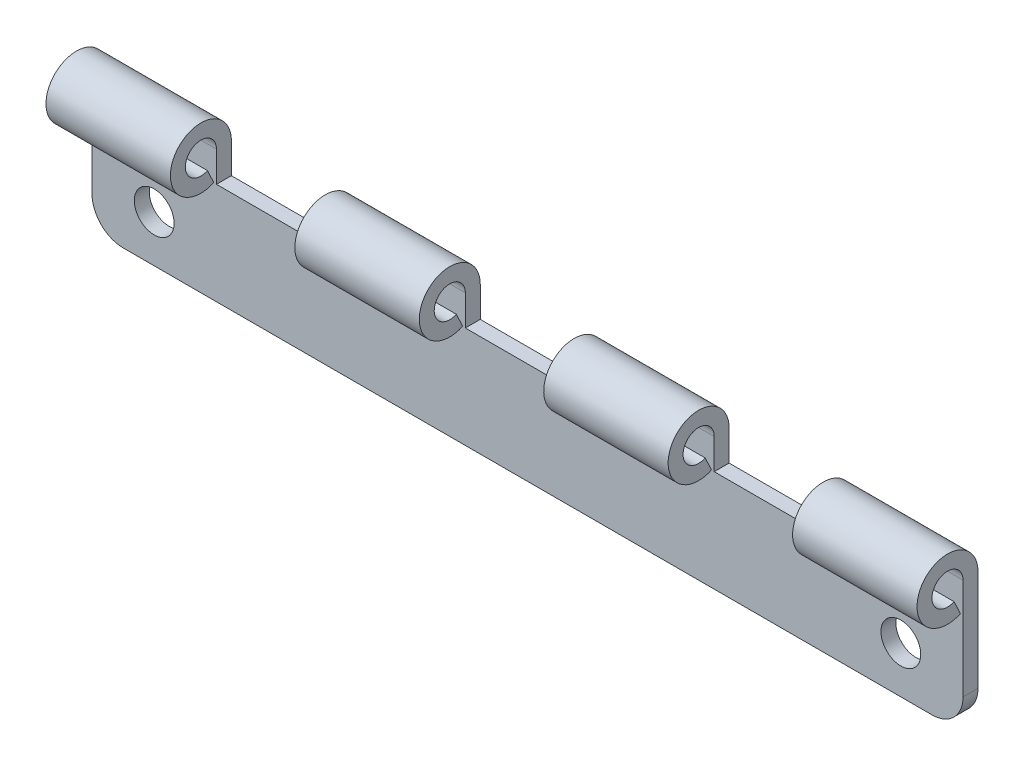
from build123d import *

# Parameters (mm, degrees)
BOSS_EXTRUDE1_DEPTH = 304.8
SKETCH4_W           = 12.7
SKETCH4_H           = 6.223
CUT_EXTRUDE1_DEPTH  = 306.114409233
LPATTERN1_COUNT     = 24
LPATTERN1_PITCH     = 25.4
BOSS_EXTRUDE2_DEPTH = 609.6
SKETCH6_W           = 12.7
SKETCH6_H           = 6.223
CUT_EXTRUDE2_DEPTH  = 306.114409233
LPATTERN2_COUNT     = 24
LPATTERN2_PITCH     = 25.4
SKETCH7_R           = 1.5875
BOSS_EXTRUDE3_DEPTH = 609.6
CHAMFER1_SIZE       = 0.3175
CUT_EXTRUDE3_START  = -88.9
SKETCH8_W           = 11.762471384
SKETCH8_H           = 30.066276354
CUT_EXTRUDE3_DEPTH  = 521.857265411
FILLET1_R           = 3.175
SKETCH9_R           = 2.032
CUT_EXTRUDE4_DEPTH  = 306.162001268


with BuildPart() as part:
    # Sketch3 → Boss-Extrude1 (new, symmetric)
    with BuildSketch(Plane(origin=(0, 0, 0), x_dir=(0, 0, -1), z_dir=(1, 0, 0))):
        with BuildLine():
            Line((1.5875, 0), (1.5875, -2.676056053))
            Line((1.5875, -2.676056053), (1.5875, -13.49375))
            Line((1.5875, -13.49375), (3.1115, -13.49375))
            Line((3.1115, -13.49375), (3.1115, 0))
            ThreePointArc((3.1115, 0), (-2.624212484, 1.671807731), (1.314976721, -2.819976679))
            Line((1.314976721, -2.819976679), (0.670906491, -1.438763612))
            ThreePointArc((0.670906491, -1.438763612), (-1.33888392, 0.852963128), (1.5875, 0))
        make_face()
    extrude(amount=BOSS_EXTRUDE1_DEPTH, both=True)

    # Sketch4 → Cut-Extrude1 (cut, symmetric)
    with BuildSketch(Plane.XY):
        with Locations((298.45, 0)):
            Rectangle(SKETCH4_W, SKETCH4_H)
    cut_extrude1 = extrude(amount=CUT_EXTRUDE1_DEPTH, both=True, mode=Mode.SUBTRACT)

    # LPattern1: Cut-Extrude1 ×24
    with Locations(*[(-i * LPATTERN1_PITCH, 0, 0) for i in range(1, LPATTERN1_COUNT)]):
        add(cut_extrude1, mode=Mode.SUBTRACT)


with BuildPart() as body_2:
    # Sketch5 → Boss-Extrude2 (new body)
    with BuildSketch(Plane(origin=(304.8, 0, 0), x_dir=(0, 0, -1), z_dir=(1, 0, 0))):
        with BuildLine():
            Line((1.5875, 13.49375), (1.5875, 2.676056053))
            Line((1.5875, 2.676056053), (1.5875, 0))
            ThreePointArc((1.5875, 0), (-1.33888392, -0.852963128), (0.670906491, 1.438763612))
            Line((0.670906491, 1.438763612), (1.314976721, 2.819976679))
            ThreePointArc((1.314976721, 2.819976679), (-2.624212484, -1.671807731), (3.1115, 0))
            Line((3.1115, 0), (3.1115, 13.49375))
            Line((3.1115, 13.49375), (1.5875, 13.49375))
        make_face()
    extrude(amount=-BOSS_EXTRUDE2_DEPTH)

    # Sketch6 → Cut-Extrude2 (cut, symmetric)
    with BuildSketch(Plane.XY):
        with Locations((285.75, 0)):
            Rectangle(SKETCH6_W, SKETCH6_H)
    cut_extrude2 = extrude(amount=CUT_EXTRUDE2_DEPTH, both=True, mode=Mode.SUBTRACT)

    # LPattern2: Cut-Extrude2 ×24
    with Locations(*[(-i * LPATTERN2_PITCH, 0, 0) for i in range(1, LPATTERN2_COUNT)]):
        add(cut_extrude2, mode=Mode.SUBTRACT)


with BuildPart() as body_3:
    # Sketch7 → Boss-Extrude3 (new body)
    with BuildSketch(Plane(origin=(304.8, 0, 0), x_dir=(0, 0, -1), z_dir=(1, 0, 0))):
        Circle(SKETCH7_R)
    extrude(amount=-BOSS_EXTRUDE3_DEPTH)

    # Chamfer1
    chamfer1_edges = [body_3.edges().sort_by_distance(p)[0] for p in [
        (304.8, 0, 1.5875),
        (-304.8, 0, 1.5875),
    ]]
    chamfer(chamfer1_edges, length=CHAMFER1_SIZE)


with BuildPart() as cut_extrude3_tool:
    # Sketch8 → Cut-Extrude3 (new, through all)
    with BuildSketch(Plane.ZY.offset(304.8).offset(CUT_EXTRUDE3_START)):
        Rectangle(SKETCH8_W, SKETCH8_H)
    extrude(amount=-CUT_EXTRUDE3_DEPTH)


with BuildPart() as part_1:
    add(part.part)

    # Cut-Extrude3: cut by cut_extrude3_tool
    add(cut_extrude3_tool.part, mode=Mode.SUBTRACT)

    # Fillet1
    fillet1_edges = [part_1.edges().sort_by_distance(p)[0] for p in [
        (-215.9, -13.49375, -2.3495),
        (-304.8, -13.49375, -2.3495),
    ]]
    fillet(fillet1_edges, radius=FILLET1_R)

    # Sketch9 → Cut-Extrude4 (cut, through all)
    with BuildSketch(Plane(origin=(0, 0, -3.1115), x_dir=(-1, 0, 0), z_dir=(0, 0, -1))):
        with Locations(Location((222.25, -8.73125, 0), (0, 0, 90))):
            Circle(SKETCH9_R)
        with Locations(Location((298.45, -8.73125, 0), (0, 0, 90))):
            Circle(SKETCH9_R)
    extrude(amount=-CUT_EXTRUDE4_DEPTH, mode=Mode.SUBTRACT)


with BuildPart() as body_2_1:
    add(body_2.part)

    # Cut-Extrude3: cut by cut_extrude3_tool
    add(cut_extrude3_tool.part, mode=Mode.SUBTRACT)


with BuildPart() as body_3_1:
    add(body_3.part)

    # Cut-Extrude3: cut by cut_extrude3_tool
    add(cut_extrude3_tool.part, mode=Mode.SUBTRACT)


solid = part_1.part
